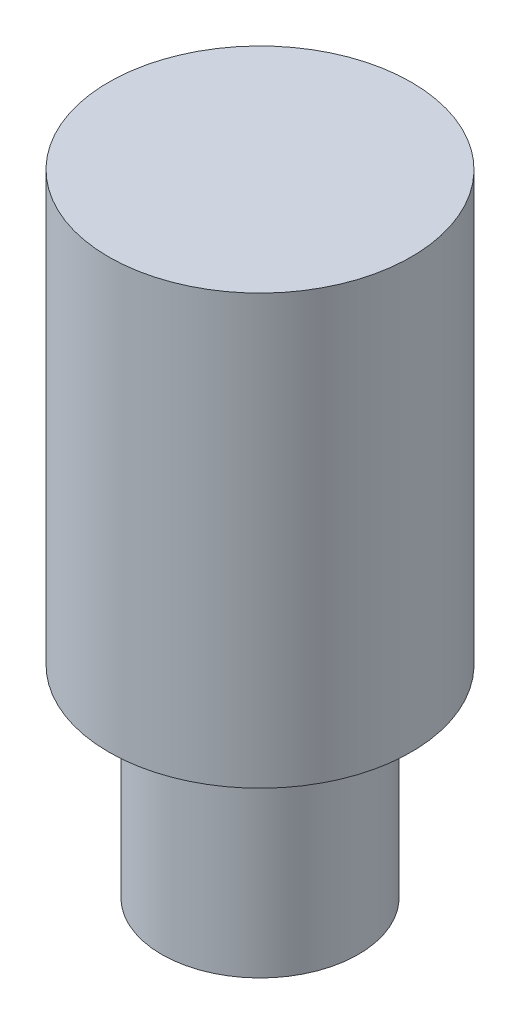
from build123d import *

# Parameters (mm, degrees)
SKETCH1_R           = 1.95
BOSS_EXTRUDE1_DEPTH = 4
SKETCH2_R           = 3
BOSS_EXTRUDE2_DEPTH = 8.5


with BuildPart() as part:
    # Sketch1 → Boss-Extrude1 (new body)
    with BuildSketch(Plane(origin=(0, 0, 0), x_dir=(1, 0, 0), z_dir=(0, 1, 0))):
        with Locations(Location((0, 0, 0), (0, 0, 270))):
            Circle(SKETCH1_R)
    extrude(amount=BOSS_EXTRUDE1_DEPTH)

    # Sketch2 → Boss-Extrude2 (add)
    with BuildSketch(Plane(origin=(0, 4, 0), x_dir=(1, 0, 0), z_dir=(0, 1, 0))):
        with Locations(Location((0, 0, 0), (0, 0, 270))):
            Circle(SKETCH2_R)
    extrude(amount=BOSS_EXTRUDE2_DEPTH)


solid = part.part
